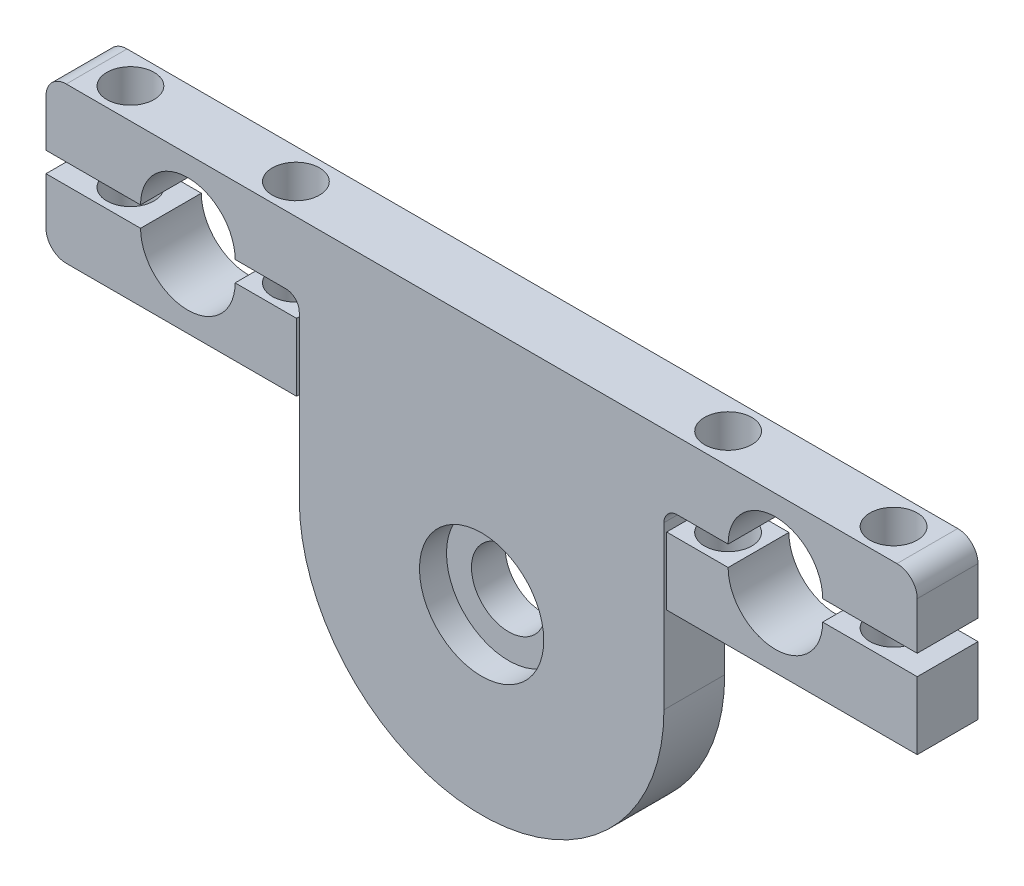
from build123d import *

# Parameters (mm, degrees)
SKETCH_1_R          = 4.6
EXTRUDE_1_DEPTH     = 4.5
SKETCH_3_R          = 4.6
EXTRUDE_2_DEPTH     = 2.5
SKETCH_4_R          = 2.75
CUT_EXTRUDE_1_DEPTH = 2.5
SKETCH_5_W          = 4.5
SKETCH_5_H          = 5
EXTRUDE_3_DEPTH     = 18.75
CUT_EXTRUDE_2_DEPTH = 18.75
SKETCH_7_R          = 1.75
CUT_EXTRUDE_3_DEPTH = 18.75
SKETCH_9_R          = 1.75
CUT_EXTRUDE_8_DEPTH = 20
SKETCH_13_W         = 0.2
SKETCH_13_H         = 5
CUT_EXTRUDE_4_DEPTH = 10
FILLET_1_R          = 1.5
FILLET_2_R          = 1.5
FILLET_3_R          = 1


with BuildPart() as part:
    # 草图1 → 凸台-拉伸1 (new body)
    with BuildSketch(Plane.XY):
        with BuildLine():
            ThreePointArc((-13.5, 0), (0, -13.5), (13.5, 0))
            Line((13.5, 0), (13.5, 18))
            Line((13.5, 18), (-13.5, 18))
            Line((-13.5, 18), (-13.5, 0))
        make_face()
        Circle(SKETCH_1_R, mode=Mode.SUBTRACT)
    extrude(amount=EXTRUDE_1_DEPTH)

    # 草图3 → 凸台-拉伸2 (add)
    with BuildSketch(Plane(origin=(0, 0, 0), x_dir=(-1, 0, 0), z_dir=(0, 0, -1))):
        Circle(SKETCH_3_R)
    extrude(amount=-EXTRUDE_2_DEPTH)

    # 草图4 → 切除-拉伸1 (cut)
    with BuildSketch(Plane(origin=(0, 0, 0), x_dir=(-1, 0, 0), z_dir=(0, 0, -1))):
        Circle(SKETCH_4_R)
    extrude(amount=-CUT_EXTRUDE_1_DEPTH, mode=Mode.SUBTRACT)

    # 草图5 → 凸台-拉伸3 (add)
    with BuildSketch(Plane(origin=(13.5, 0, 0), x_dir=(0, 0, -1), z_dir=(1, 0, 0))):
        with Locations((-2.25, 15.5)):
            Rectangle(SKETCH_5_W, SKETCH_5_H)
        with Locations((-2.25, 9)):
            Rectangle(SKETCH_5_W, SKETCH_5_H)
    extrude_3 = extrude(amount=EXTRUDE_3_DEPTH)

    # 草图6 → 切除-拉伸2 (cut)
    with BuildSketch(Plane(origin=(0, 0, 0), x_dir=(-1, 0, 0), z_dir=(0, 0, -1))):
        with BuildLine():
            ThreePointArc((-25.25, 11.5), (-21.75, 8), (-18.25, 11.5))
            Line((-18.25, 11.5), (-25.25, 11.5))
        make_face()
        with BuildLine():
            ThreePointArc((-25.25, 13), (-21.75, 16.5), (-18.25, 13))
            Line((-18.25, 13), (-25.25, 13))
        make_face()
    cut_extrude_2 = extrude(amount=-CUT_EXTRUDE_2_DEPTH, mode=Mode.SUBTRACT)

    # 草图7 → 切除-拉伸3 (cut)
    with BuildSketch(Plane(origin=(0, 18, 0), x_dir=(1, 0, 0), z_dir=(0, 1, 0))):
        with Locations(Location((28.25, -2.25, 0), (0, 0, 270))):
            Circle(SKETCH_7_R)
    cut_extrude_3 = extrude(amount=-CUT_EXTRUDE_3_DEPTH, mode=Mode.SUBTRACT)

    # 草图9 → 切除-拉伸8 (cut)
    with BuildSketch(Plane(origin=(0, 18, 0), x_dir=(1, 0, 0), z_dir=(0, 1, 0))):
        with Locations(Location((16, -2.25, 0), (0, 0, 270))):
            Circle(SKETCH_9_R)
    cut_extrude_8 = extrude(amount=-CUT_EXTRUDE_8_DEPTH, mode=Mode.SUBTRACT)

    # 镜向3: 凸台-拉伸3, 切除-拉伸2, 切除-拉伸3, 切除-拉伸8 across plane
    add(extrude_3.mirror(Plane(origin=(0, 0, 0), x_dir=(0, 0, 1), z_dir=(1, 0, 0))))
    add(cut_extrude_2.mirror(Plane(origin=(0, 0, 0), x_dir=(0, 0, 1), z_dir=(1, 0, 0))), mode=Mode.SUBTRACT)
    add(cut_extrude_3.mirror(Plane(origin=(0, 0, 0), x_dir=(0, 0, 1), z_dir=(1, 0, 0))), mode=Mode.SUBTRACT)
    add(cut_extrude_8.mirror(Plane(origin=(0, 0, 0), x_dir=(0, 0, 1), z_dir=(1, 0, 0))), mode=Mode.SUBTRACT)

    # 草图13 → 切除-拉伸-薄壁4 (cut)
    with BuildSketch(Plane.XY.offset(4.5)):
        with Locations((-13.6, 9)):
            Rectangle(SKETCH_13_W, SKETCH_13_H)
        with Locations((13.6, 9)):
            Rectangle(SKETCH_13_W, SKETCH_13_H)
    extrude(amount=-CUT_EXTRUDE_4_DEPTH, mode=Mode.SUBTRACT)


with BuildPart() as cut_extrude_4_piece_1:
    # of the separate pieces the step leaves, piece 1, a body of its own (cut_extrude_4_pieces)
    add(part.part.solids().sort_by_distance((13.5, 0, 0))[0])

    # 圆角1
    fillet_1_edges = [cut_extrude_4_piece_1.edges().sort_by_distance(p)[0] for p in [
        (-32.25, 18, 2.25),
        (32.25, 18, 2.25),
    ]]
    fillet(fillet_1_edges, radius=FILLET_1_R)

    # 圆角3
    fillet_3_edges = [cut_extrude_4_piece_1.edges().sort_by_distance(p)[0] for p in [
        (-13.5, 13, 2.25),
        (13.5, 13, 2.25),
    ]]
    fillet(fillet_3_edges, radius=FILLET_3_R)


with BuildPart() as cut_extrude_4_piece_2:
    # of the separate pieces the step leaves, piece 2, a body of its own (cut_extrude_4_pieces)
    add(part.part.solids().sort_by_distance((-13.7, 6.5, 0))[0])

    # 圆角2
    fillet_2_edges = [cut_extrude_4_piece_2.edges().sort_by_distance(p)[0] for p in [
        (-32.25, 6.5, 2.25),
    ]]
    fillet(fillet_2_edges, radius=FILLET_2_R)


with BuildPart() as cut_extrude_4_piece_3:
    # of the separate pieces the step leaves, piece 3, a body of its own (cut_extrude_4_pieces)
    add(part.part.solids().sort_by_distance((13.7, 6.5, 4.5))[0])


solid = Compound([cut_extrude_4_piece_1.part, cut_extrude_4_piece_2.part, cut_extrude_4_piece_3.part])
